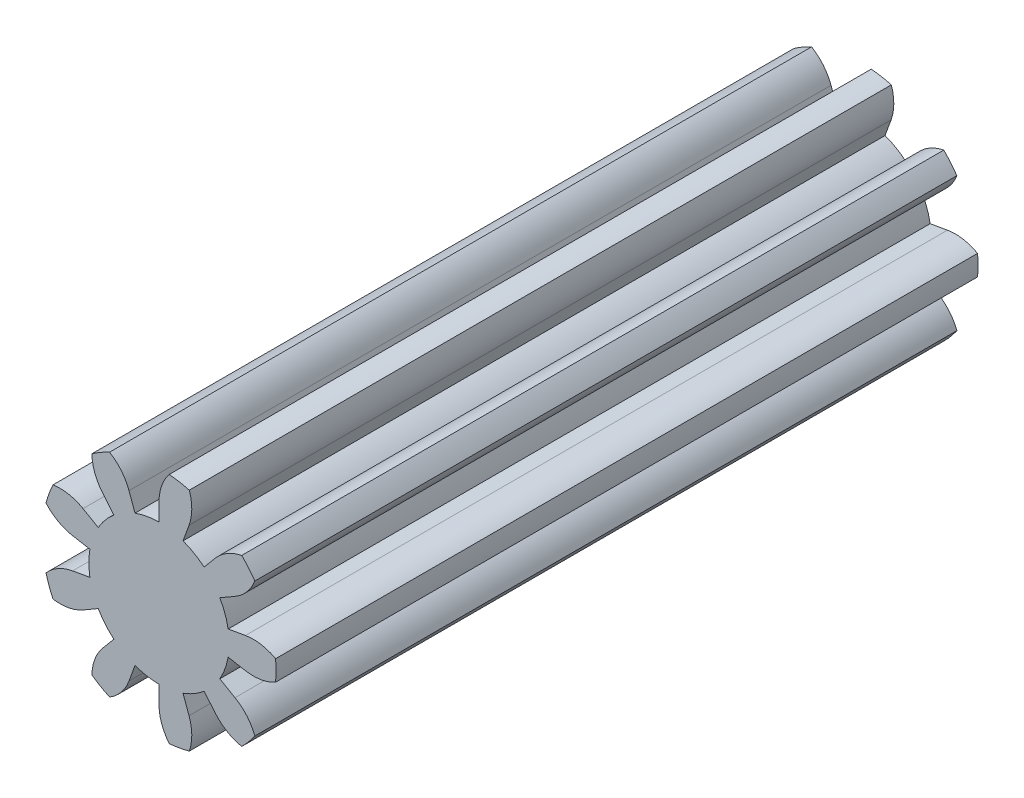
from build123d import *

# Parameters (mm, degrees)
BOSS_EXTRUDE1_DEPTH = 6


with BuildPart() as part:
    # Sketch1 → Boss-Extrude1 (new body)
    with BuildSketch(Plane.XY):
        with BuildLine():
            Line((0.590884652, 0.104188907), (0.738605815, 0.130236133))
            ThreePointArc((0.738605815, 0.130236133), (0.871100483, 0.13082056), (0.996194698, 0.087155743))
            ThreePointArc((0.996194698, 0.087155743), (1, 0), (0.996194698, -0.087155743))
            ThreePointArc((0.996194698, -0.087155743), (0.871100483, -0.13082056), (0.738605815, -0.130236133))
            Line((0.738605815, -0.130236133), (0.590884652, -0.104188907))
            ThreePointArc((0.590884652, -0.104188907), (0.579555496, -0.155291427), (0.563815572, -0.205212086))
            ThreePointArc((0.563815572, -0.205212086), (0.543784672, -0.253570957), (0.519615242, -0.3))
            Line((0.519615242, -0.3), (0.649519053, -0.375))
            ThreePointArc((0.649519053, -0.375), (0.75139152, -0.459718235), (0.819152044, -0.573576436))
            ThreePointArc((0.819152044, -0.573576436), (0.766044443, -0.64278761), (0.707106781, -0.707106781))
            ThreePointArc((0.707106781, -0.707106781), (0.58321185, -0.660146961), (0.482090707, -0.574533332))
            Line((0.482090707, -0.574533332), (0.385672566, -0.459626666))
            ThreePointArc((0.385672566, -0.459626666), (0.344145862, -0.491491227), (0.3, -0.519615242))
            ThreePointArc((0.3, -0.519615242), (0.253570957, -0.543784672), (0.205212086, -0.563815572))
            Line((0.205212086, -0.563815572), (0.256515107, -0.704769466))
            ThreePointArc((0.256515107, -0.704769466), (0.280098113, -0.835149758), (0.258819045, -0.965925826))
            ThreePointArc((0.258819045, -0.965925826), (0.173648178, -0.984807753), (0.087155743, -0.996194698))
            ThreePointArc((0.087155743, -0.996194698), (0.02243191, -0.880583262), (0, -0.75))
            Line((0, -0.75), (0, -0.6))
            ThreePointArc((0, -0.6), (-0.052293446, -0.597716819), (-0.104188907, -0.590884652))
            ThreePointArc((-0.104188907, -0.590884652), (-0.155291427, -0.579555496), (-0.205212086, -0.563815572))
            Line((-0.205212086, -0.563815572), (-0.256515107, -0.704769466))
            ThreePointArc((-0.256515107, -0.704769466), (-0.322256313, -0.819805428), (-0.422618262, -0.906307787))
            ThreePointArc((-0.422618262, -0.906307787), (-0.5, -0.866025404), (-0.573576436, -0.819152044))
            ThreePointArc((-0.573576436, -0.819152044), (-0.54884417, -0.688984868), (-0.482090707, -0.574533332))
            Line((-0.482090707, -0.574533332), (-0.385672566, -0.459626666))
            ThreePointArc((-0.385672566, -0.459626666), (-0.424264069, -0.424264069), (-0.459626666, -0.385672566))
            ThreePointArc((-0.459626666, -0.385672566), (-0.491491227, -0.344145862), (-0.519615242, -0.3))
            Line((-0.519615242, -0.3), (-0.649519053, -0.375))
            ThreePointArc((-0.649519053, -0.375), (-0.77382343, -0.420865027), (-0.906307787, -0.422618262))
            ThreePointArc((-0.906307787, -0.422618262), (-0.939692621, -0.342020143), (-0.965925826, -0.258819045))
            ThreePointArc((-0.965925826, -0.258819045), (-0.863309963, -0.175002797), (-0.738605815, -0.130236133))
            Line((-0.738605815, -0.130236133), (-0.590884652, -0.104188907))
            ThreePointArc((-0.590884652, -0.104188907), (-0.597716819, -0.052293446), (-0.6, 0))
            ThreePointArc((-0.6, 0), (-0.597716819, 0.052293446), (-0.590884652, 0.104188907))
            Line((-0.590884652, 0.104188907), (-0.738605815, 0.130236133))
            ThreePointArc((-0.738605815, 0.130236133), (-0.863309963, 0.175002797), (-0.965925826, 0.258819045))
            ThreePointArc((-0.965925826, 0.258819045), (-0.939692621, 0.342020143), (-0.906307787, 0.422618262))
            ThreePointArc((-0.906307787, 0.422618262), (-0.77382343, 0.420865027), (-0.649519053, 0.375))
            Line((-0.649519053, 0.375), (-0.519615242, 0.3))
            ThreePointArc((-0.519615242, 0.3), (-0.491491227, 0.344145862), (-0.459626666, 0.385672566))
            ThreePointArc((-0.459626666, 0.385672566), (-0.424264069, 0.424264069), (-0.385672566, 0.459626666))
            Line((-0.385672566, 0.459626666), (-0.482090707, 0.574533332))
            ThreePointArc((-0.482090707, 0.574533332), (-0.54884417, 0.688984868), (-0.573576436, 0.819152044))
            ThreePointArc((-0.573576436, 0.819152044), (-0.5, 0.866025404), (-0.422618262, 0.906307787))
            ThreePointArc((-0.422618262, 0.906307787), (-0.322256313, 0.819805428), (-0.256515107, 0.704769466))
            Line((-0.256515107, 0.704769466), (-0.205212086, 0.563815572))
            ThreePointArc((-0.205212086, 0.563815572), (-0.155291427, 0.579555496), (-0.104188907, 0.590884652))
            ThreePointArc((-0.104188907, 0.590884652), (-0.052293446, 0.597716819), (0, 0.6))
            Line((0, 0.6), (0, 0.75))
            ThreePointArc((0, 0.75), (0.02243191, 0.880583262), (0.087155743, 0.996194698))
            ThreePointArc((0.087155743, 0.996194698), (0.173648178, 0.984807753), (0.258819045, 0.965925826))
            ThreePointArc((0.258819045, 0.965925826), (0.280098113, 0.835149758), (0.256515107, 0.704769466))
            Line((0.256515107, 0.704769466), (0.205212086, 0.563815572))
            ThreePointArc((0.205212086, 0.563815572), (0.253570957, 0.543784672), (0.3, 0.519615242))
            ThreePointArc((0.3, 0.519615242), (0.344145862, 0.491491227), (0.385672566, 0.459626666))
            Line((0.385672566, 0.459626666), (0.482090707, 0.574533332))
            ThreePointArc((0.482090707, 0.574533332), (0.58321185, 0.660146961), (0.707106781, 0.707106781))
            ThreePointArc((0.707106781, 0.707106781), (0.766044443, 0.64278761), (0.819152044, 0.573576436))
            ThreePointArc((0.819152044, 0.573576436), (0.75139152, 0.459718235), (0.649519053, 0.375))
            Line((0.649519053, 0.375), (0.519615242, 0.3))
            ThreePointArc((0.519615242, 0.3), (0.543784672, 0.253570957), (0.563815572, 0.205212086))
            ThreePointArc((0.563815572, 0.205212086), (0.579555496, 0.155291427), (0.590884652, 0.104188907))
        make_face()
    extrude(amount=BOSS_EXTRUDE1_DEPTH)


solid = part.part
